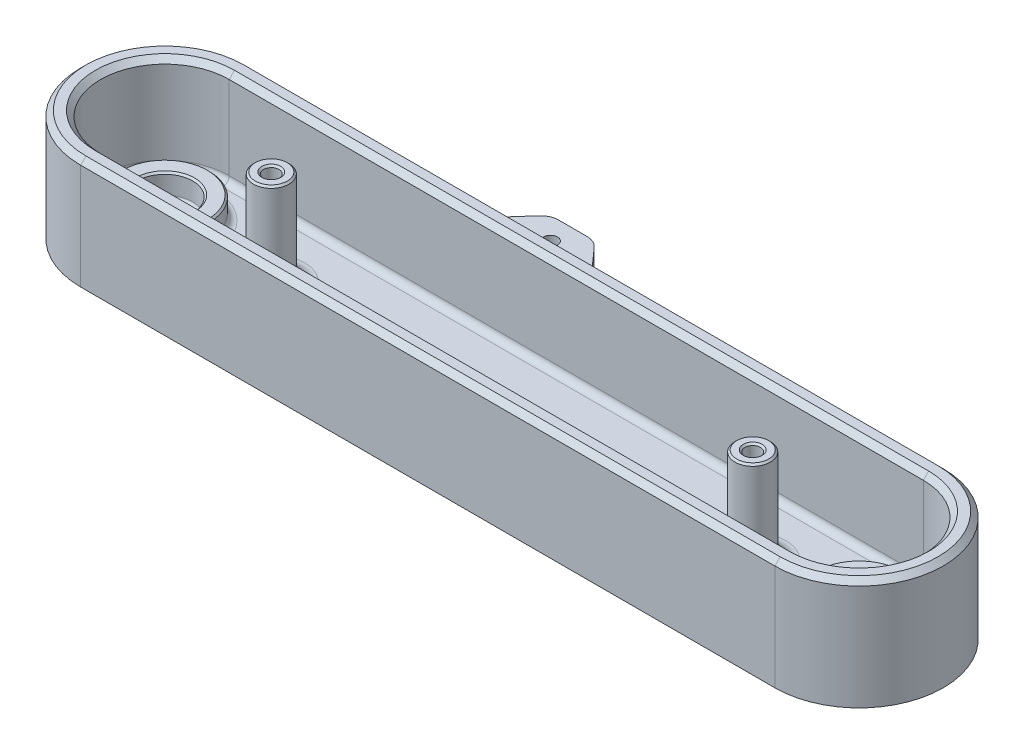
from build123d import *

# Parameters (mm, degrees)
MAINBLOCK_DEPTH      = 31.75
MAINPOCKET_DEPTH     = 27.305
SKETCH3_R            = 4.445
CUT_EXTRUDE1_DEPTH   = 130.846491832
SKETCH4_R            = 12.7
SKETCH4_R_2          = 7.95655
BOSS_EXTRUDE1_DEPTH  = 6.35
SKETCH7_R            = 5.08
SKETCH7_R_2          = 2.2225
BOSS_EXTRUDE3_DEPTH  = 27.305
FILLET2_R            = 0.635
FILLET3_R            = 1.905
FILLET6_R            = 4.445
CHAMFER2_SIZE        = 0.508
SKETCH12_R           = 2.0066
STAB_BAR_MOUNT_DEPTH = 25.4
CHAMFER3_SIZE        = 1.524
SKETCH10_R           = 2.2225
BOSS_EXTRUDE4_DEPTH  = 16.51
SKETCH11_R           = 3.175
CUT_EXTRUDE2_DEPTH   = 132.452914254
FILLET8_R            = 5.08


with BuildPart() as part:
    # Sketch1 → MainBlock (new body)
    with BuildSketch(Plane(origin=(0, 0, 0), x_dir=(1, 0, 0), z_dir=(0, 1, 0))):
        with BuildLine():
            Line((-99.441, 24.13), (99.441, 24.13))
            ThreePointArc((99.441, 24.13), (123.571, 0), (99.441, -24.13))
            Line((99.441, -24.13), (-99.441, -24.13))
            ThreePointArc((-99.441, -24.13), (-123.571, 0), (-99.441, 24.13))
        make_face()
    extrude(amount=MAINBLOCK_DEPTH)

    # Sketch2 → MainPocket (cut)
    with BuildSketch(Plane(origin=(0, 31.75, 0), x_dir=(1, 0, 0), z_dir=(0, 1, 0))):
        with BuildLine():
            Line((-99.441, 18.415), (99.441, 18.415))
            ThreePointArc((99.441, 18.415), (117.856, 0), (99.441, -18.415))
            Line((99.441, -18.415), (-99.441, -18.415))
            ThreePointArc((-99.441, -18.415), (-117.856, 0), (-99.441, 18.415))
        make_face()
    extrude(amount=-MAINPOCKET_DEPTH, mode=Mode.SUBTRACT)

    # Sketch3 → Cut-Extrude1 (cut, through all)
    with BuildSketch(Plane.XZ):
        with Locations(Location((-99.441, 0, 0), (0, 0, 270))):
            Circle(SKETCH3_R)
        with Locations(Location((99.441, 0, 0), (0, 0, 270))):
            Circle(SKETCH3_R)
    extrude(amount=-CUT_EXTRUDE1_DEPTH, mode=Mode.SUBTRACT)

    # Sketch4 → Boss-Extrude1 (add)
    # profile 1 of 2: a face of its own
    with BuildSketch(Plane(origin=(0, 4.445, 0), x_dir=(1, 0, 0), z_dir=(0, 1, 0))):
        with Locations(Location((-99.441, 0, 0), (0, 0, 270))):
            Circle(SKETCH4_R)
        with Locations(Location((-99.441, 0, 0), (0, 0, 270))):
            Circle(SKETCH4_R_2, mode=Mode.SUBTRACT)
    # profile 2 of 2: a face of its own
    with BuildSketch(Plane(origin=(0, 4.445, 0), x_dir=(1, 0, 0), z_dir=(0, 1, 0))):
        with Locations(Location((99.441, 0, 0), (0, 0, 90))):
            Circle(SKETCH4_R)
        with Locations(Location((99.441, 0, 0), (0, 0, 90))):
            Circle(SKETCH4_R_2, mode=Mode.SUBTRACT)
    extrude(amount=BOSS_EXTRUDE1_DEPTH)

    # Sketch7 → Boss-Extrude3 (add)
    # profile 1 of 2: a face of its own
    with BuildSketch(Plane(origin=(0, 4.445, 0), x_dir=(1, 0, 0), z_dir=(0, 1, 0))):
        with Locations(Location((-68.961, 0, 0), (0, 0, 270))):
            Circle(SKETCH7_R)
        with Locations(Location((-68.961, 0, 0), (0, 0, 270))):
            Circle(SKETCH7_R_2, mode=Mode.SUBTRACT)
    # profile 2 of 2: a face of its own
    with BuildSketch(Plane(origin=(0, 4.445, 0), x_dir=(1, 0, 0), z_dir=(0, 1, 0))):
        with Locations(Location((68.961, 0, 0), (0, 0, 270))):
            Circle(SKETCH7_R)
        with Locations(Location((68.961, 0, 0), (0, 0, 270))):
            Circle(SKETCH7_R_2, mode=Mode.SUBTRACT)
    extrude(amount=BOSS_EXTRUDE3_DEPTH)

    # Fillet2
    fillet2_edges = [part.edges().sort_by_distance(p)[0] for p in [
        (-99.441, 4.445, -7.95655),
        (99.441, 4.445, 7.95655),
    ]]
    fillet(fillet2_edges, radius=FILLET2_R)

    # Fillet3
    fillet3_edges = [part.edges().sort_by_distance(p)[0] for p in [
        (117.856, 4.445, 0),
        (0, 4.445, 18.415),
        (-117.856, 4.445, 0),
        (0, 4.445, -18.415),
        (-99.441, 4.445, -12.7),
        (99.441, 4.445, 12.7),
    ]]
    fillet(fillet3_edges, radius=FILLET3_R)

    # Fillet6
    fillet6_edges = [part.edges().sort_by_distance(p)[0] for p in [
        (-68.961, 4.445, -5.08),
        (68.961, 4.445, -5.08),
    ]]
    fillet(fillet6_edges, radius=FILLET6_R)

    # Chamfer2
    chamfer2_edges = [part.edges().sort_by_distance(p)[0] for p in [
        (-99.441, 4.445, 4.445),
        (99.441, 4.445, 4.445),
        (-99.441, 10.795, -12.7),
        (-99.441, 10.795, -7.95655),
        (99.441, 10.795, 12.7),
        (99.441, 10.795, 7.95655),
        (-68.961, 31.75, -2.2225),
        (-68.961, 31.75, -5.08),
        (68.961, 31.75, -2.2225),
        (68.961, 31.75, -5.08),
    ]]
    chamfer(chamfer2_edges, length=CHAMFER2_SIZE)

    # Sketch12 → Stab_bar_Mount (add)
    with BuildSketch(Plane(origin=(0, 0, 0), x_dir=(1, 0, 0), z_dir=(0, 1, 0))):
        Polygon((-34.671, 24.13), (-24.511, 35.56), (-11.811, 35.56), (-1.651, 24.13), align=None)
        with Locations(Location((-18.161, 29.21, 0), (0, 0, 270))):
            Circle(SKETCH12_R, mode=Mode.SUBTRACT)
    extrude(amount=STAB_BAR_MOUNT_DEPTH)

    # Chamfer3
    chamfer3_edges = [part.edges().sort_by_distance(p)[0] for p in [
        (123.571, 31.75, 0),
        (0, 31.75, -24.13),
        (117.856, 31.75, 0),
        (0, 31.75, -18.415),
        (-117.856, 31.75, 0),
        (0, 31.75, 18.415),
        (-123.571, 31.75, 0),
        (0, 31.75, 24.13),
    ]]
    chamfer(chamfer3_edges, length=CHAMFER3_SIZE)

    # Sketch10 → Boss-Extrude4 (add)
    with BuildSketch(Plane(origin=(0, 4.445, 0), x_dir=(1, 0, 0), z_dir=(0, 1, 0))):
        with Locations(Location((68.961, 0, 0), (0, 0, 270))):
            Circle(SKETCH10_R)
        with Locations(Location((-68.961, 0, 0), (0, 0, 270))):
            Circle(SKETCH10_R)
    extrude(amount=BOSS_EXTRUDE4_DEPTH)

    # Sketch11 → Cut-Extrude2 (cut, through all)
    with BuildSketch(Plane(origin=(0, 4.445, 0), x_dir=(1, 0, 0), z_dir=(0, 1, 0))):
        with Locations(Location((-9.271, 0, 0), (0, 0, 270))):
            Circle(SKETCH11_R)
    extrude(amount=-CUT_EXTRUDE2_DEPTH, mode=Mode.SUBTRACT)

    # Fillet8
    fillet8_edges = [part.edges().sort_by_distance(p)[0] for p in [
        (-34.671, 12.7, -24.13),
        (-1.651, 12.7, -24.13),
        (-11.811, 12.7, -35.56),
        (-24.511, 12.7, -35.56),
    ]]
    fillet(fillet8_edges, radius=FILLET8_R)


solid = part.part
